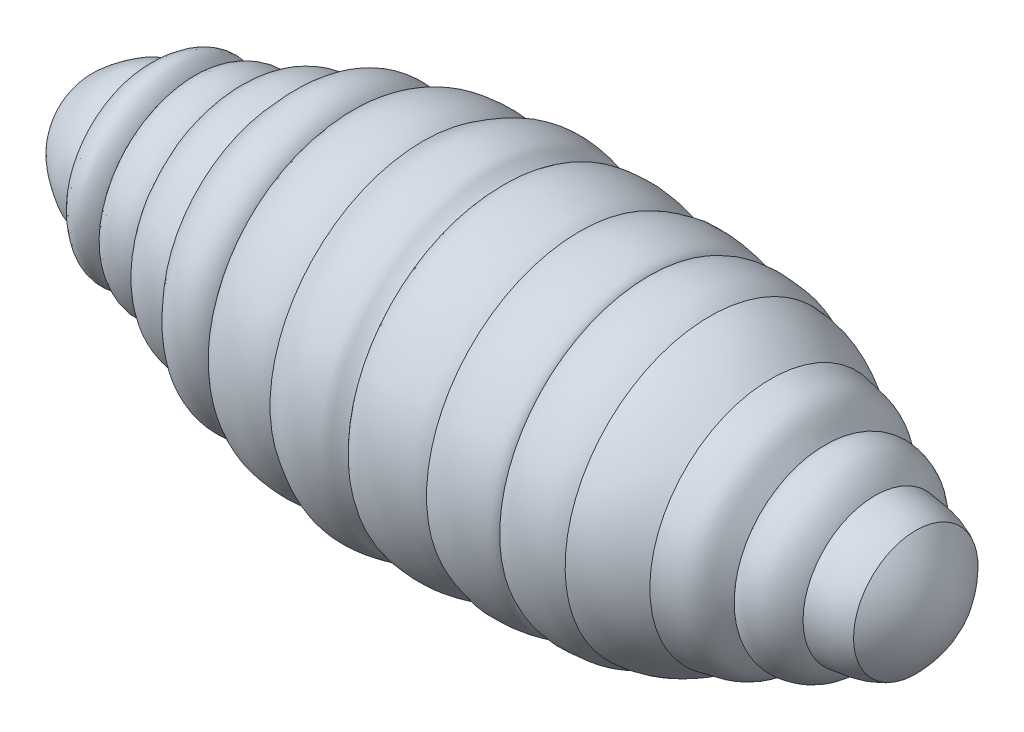
from build123d import *


with BuildPart() as part:
    # Schizzo1 → Rivoluzione4 (revolve)
    with BuildSketch(Plane.XY):
        with BuildLine():
            add(Edge.make_bspline(
                [(-42, 8.281047388), (-41.920928701, 9.137759341), (-41.092769971, 10.01958436), (-39.870756596, 10.889048912), (-38.902236872, 10.930364357), (-38.320590615, 10.520706331), (-37.60672462, 9.861952861), (-37.214057424, 9.182465857), (-37, 8.669452885)],
                knots=[0, 0, 0, 0, 0.321142073, 0.487409852, 0.601009199, 0.689328176, 0.770139837, 1, 1, 1, 1], degree=3))
            add(Edge.make_bspline(
                [(-48.708348286, 4.516579364), (-48.05033982, 5.483279796), (-46.586206378, 6.572443054), (-44.381278745, 8.042433256), (-42.86947313, 8.267085342), (-42, 8.281047388)],
                knots=[0.374016398, 0.374016398, 0.374016398, 0.374016398, 0.65347801, 0.7909604, 1, 1, 1, 1], degree=3))
            add(Edge.make_bspline(
                [(-48.708348286, 4.516579364), (-49.234755644, 3.608266029), (-49.547611076, 2.684302119)],
                knots=[6.055391404, 6.055391404, 6.055391404, 6.148563948, 6.148563948, 6.148563948], degree=2, weights=[1, 0.998915056, 1]))
            add(Edge.make_bspline(
                [(-50, 0), (-49.937064315, 0.864822942), (-49.810754354, 1.799843245), (-49.547611076, 2.684302119)],
                knots=[0, 0, 0, 0, 0.214909024, 0.214909024, 0.214909024, 0.214909024], degree=3))
            Line((-50, 0), (50, 0))
            add(Edge.make_bspline(
                [(50, 0), (50, 3.701091183), (46.688871247, 7.157086577)],
                knots=[3.141592654, 3.141592654, 3.141592654, 3.507561692, 3.507561692, 3.507561692], degree=2, weights=[1, 0.983304995, 1]))
            add(Edge.make_bspline(
                [(42, 8.281047388), (43.595591978, 8.095438288), (45.25311792, 7.960655244), (46.688871247, 7.157086577)],
                knots=[0, 0, 0, 0, 1, 1, 1, 1], degree=3))
            add(Edge.make_bspline(
                [(36, 10.096770015), (36.164899774, 10.439442319), (36.69635178, 10.869149237), (37.74586276, 11.078212866), (38.687500101, 10.875779286), (39.765691934, 10.549759727), (40.897084526, 9.682087738), (41.642222356, 8.853422002), (42, 8.281047388)],
                knots=[0, 0, 0, 0, 0.152464573, 0.266191498, 0.427434589, 0.541585928, 0.725793912, 1, 1, 1, 1], degree=3))
            add(Edge.make_bspline(
                [(30, 13.903740197), (31.198333342, 13.619825725), (34.078915725, 13.506124818), (35.349792204, 11.004735033), (36, 10.096770015)],
                knots=[0, 0, 0, 0, 0.529447084, 1, 1, 1, 1], degree=3))
            add(Edge.make_bspline(
                [(23, 16.647979824), (25.621013296, 16.563310264), (27.904434931, 15.307377925), (30, 13.903740197)],
                knots=[0, 0, 0, 0, 1, 1, 1, 1], degree=3))
            add(Edge.make_bspline(
                [(16, 17.172769626), (16.409230685, 17.396852459), (17.018543871, 17.589453258), (17.907121077, 17.638800006), (18.204693061, 17.682365713), (18.607659449, 17.680884862), (18.951486991, 17.64123991), (20.313568849, 17.554875914), (21.409631282, 17.438918614), (22.544834093, 16.92244332), (23, 16.647979824)],
                knots=[0, 0, 0, 0, 0.20115166, 0.294305632, 0.364002236, 0.381415257, 0.46843584, 0.545691856, 0.779325231, 1, 1, 1, 1], degree=3))
            add(Edge.make_bspline(
                [(8, 17.588795583), (8.581951722, 17.880415979), (9.439989163, 18.052799001), (10.508152133, 18.334125134), (11.0618502, 18.297653454), (11.504045551, 18.299425124), (11.866363218, 18.309329607), (12.260615533, 18.267428003), (12.639076817, 18.231168998), (12.999538019, 18.187185925), (13.429476861, 18.131599424), (14.035419037, 18.008194846), (14.973698644, 17.825498382), (15.708897745, 17.556170403), (16, 17.172769626)],
                knots=[0, 0, 0, 0, 0.229372755, 0.317536007, 0.393855894, 0.427343112, 0.476843965, 0.524044559, 0.569820457, 0.613701787, 0.654707152, 0.72580178, 0.835933876, 1, 1, 1, 1], degree=3))
            add(Edge.make_bspline(
                [(-1, 17.588795583), (-0.614381517, 18.104201355), (0.33373508, 18.632641409), (1.652794481, 18.723773831), (2.53495211, 18.794772534), (3.272245155, 18.796180751), (3.89160747, 18.745865054), (4.475220008, 18.667212173), (4.992232521, 18.561560177), (5.542562506, 18.466666486), (6.114775901, 18.284622468), (6.681189576, 18.183291401), (7.330549371, 17.980405814), (7.737592637, 17.748797975), (8, 17.588795583)],
                knots=[0, 0, 0, 0, 0.19999337, 0.323104104, 0.414620344, 0.479251546, 0.555247359, 0.610372735, 0.664792722, 0.721612681, 0.786226373, 0.853650458, 0.902782427, 1, 1, 1, 1], degree=3))
            add(Edge.make_bspline(
                [(-10, 17.588795583), (-9.177640336, 18.086537953), (-7.798339755, 19.006968429), (-5.523541506, 19.318007794), (-3.936116913, 19.069156303), (-2.289211867, 18.752878882), (-1.616362993, 17.847197056), (-1, 17.588795583)],
                knots=[0, 0, 0, 0, 0.297871953, 0.496695395, 0.687344485, 0.793867052, 1, 1, 1, 1], degree=3))
            add(Edge.make_bspline(
                [(-19, 14.781376887), (-18.875934195, 16.028850536), (-17.57470819, 17.288440009), (-15.509771075, 18.075362609), (-14.023892113, 18.227221045), (-12.161510462, 18.392970535), (-10.797574386, 18.040114527), (-10, 17.588795583)],
                knots=[0, 0, 0, 0, 0.324864627, 0.474838109, 0.616409352, 0.74338577, 1, 1, 1, 1], degree=3))
            add(Edge.make_bspline(
                [(-26, 13.903740197), (-25.251899359, 14.696598848), (-24.203412338, 16.192179565), (-22.10966123, 16.67017973), (-20.365009815, 16.382364292), (-19.344111288, 15.54259426), (-19, 14.781376887)],
                knots=[0, 0, 0, 0, 0.396544677, 0.574715816, 0.715438823, 1, 1, 1, 1], degree=3))
            add(Edge.make_bspline(
                [(-32, 11.207580376), (-31.463877263, 12.095566033), (-30.504364925, 13.362444514), (-28.223448583, 14.201361086), (-26.870161367, 13.991889653), (-26, 13.903740197)],
                knots=[0, 0, 0, 0, 0.447477162, 0.624963351, 1, 1, 1, 1], degree=3))
            add(Edge.make_bspline(
                [(-37, 8.669452885), (-36.87497218, 9.410259784), (-36.755259998, 10.860592392), (-35.556407174, 11.468057963), (-34.994332182, 11.703673338), (-34.397215298, 11.722417647), (-33.846437797, 11.732623301), (-33.352067001, 11.681783497), (-32.935278868, 11.625258925), (-32.491096234, 11.487967975), (-32.190086118, 11.325095327), (-32, 11.207580376)],
                knots=[0, 0, 0, 0, 0.382043088, 0.47029916, 0.564740486, 0.641238462, 0.723825006, 0.801482707, 0.854067905, 0.904002141, 1, 1, 1, 1], degree=3))
        make_face()
    revolve(axis=Axis((-50, 0, 0), (1, 0, 0)))


solid = part.part
